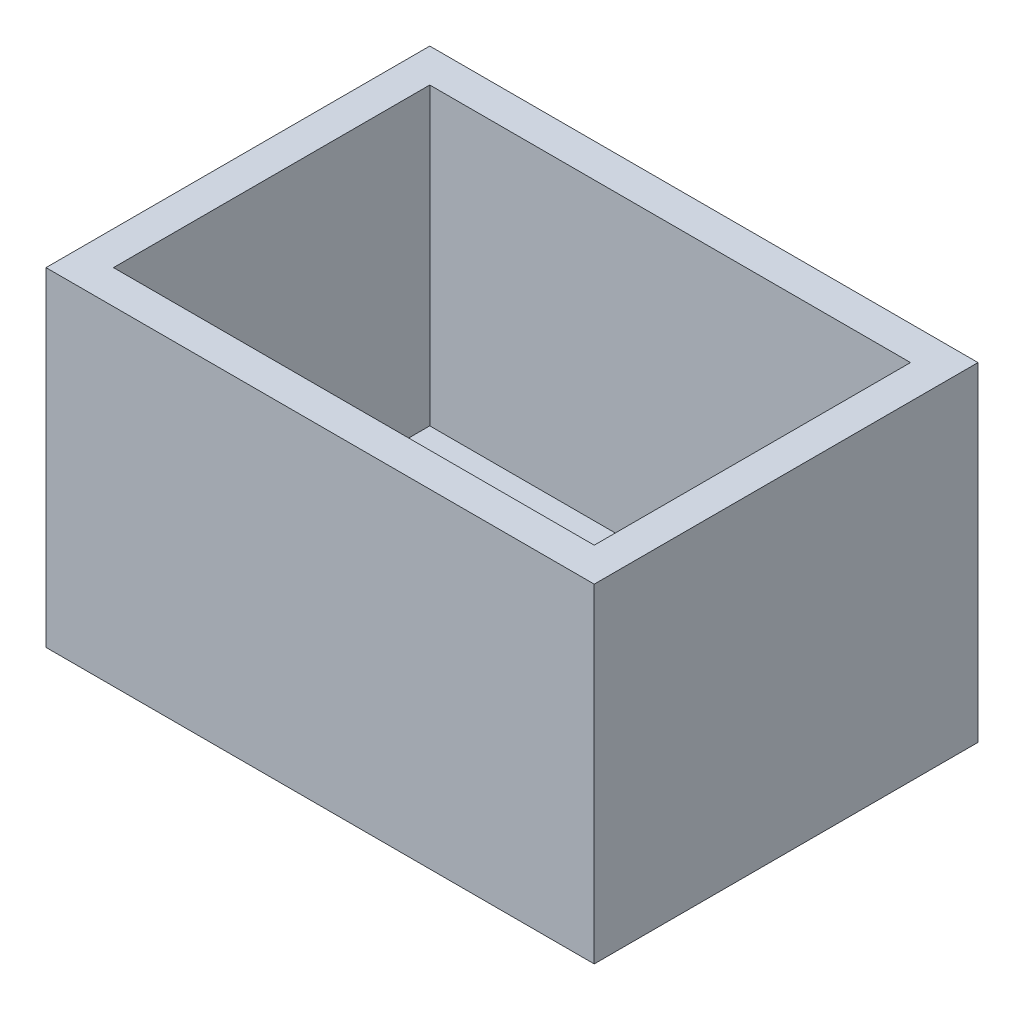
from build123d import *

# Parameters (mm, degrees)
SKETCH1_W           = 32.5
SKETCH1_H           = 22.75
BOSS_EXTRUDE1_DEPTH = 19.5
SHELL1_T            = -2


with BuildPart() as part:
    # Sketch1 → Boss-Extrude1 (new body)
    with BuildSketch(Plane(origin=(0, 0, 0), x_dir=(1, 0, 0), z_dir=(0, 1, 0))):
        Rectangle(SKETCH1_W, SKETCH1_H)
    extrude(amount=BOSS_EXTRUDE1_DEPTH)

    # Shell1
    shell1_openings = [part.faces().sort_by_distance(p)[0] for p in [
        (0, 19.5, 0),
    ]]
    offset(amount=SHELL1_T, openings=shell1_openings, kind=Kind.INTERSECTION)


solid = part.part
